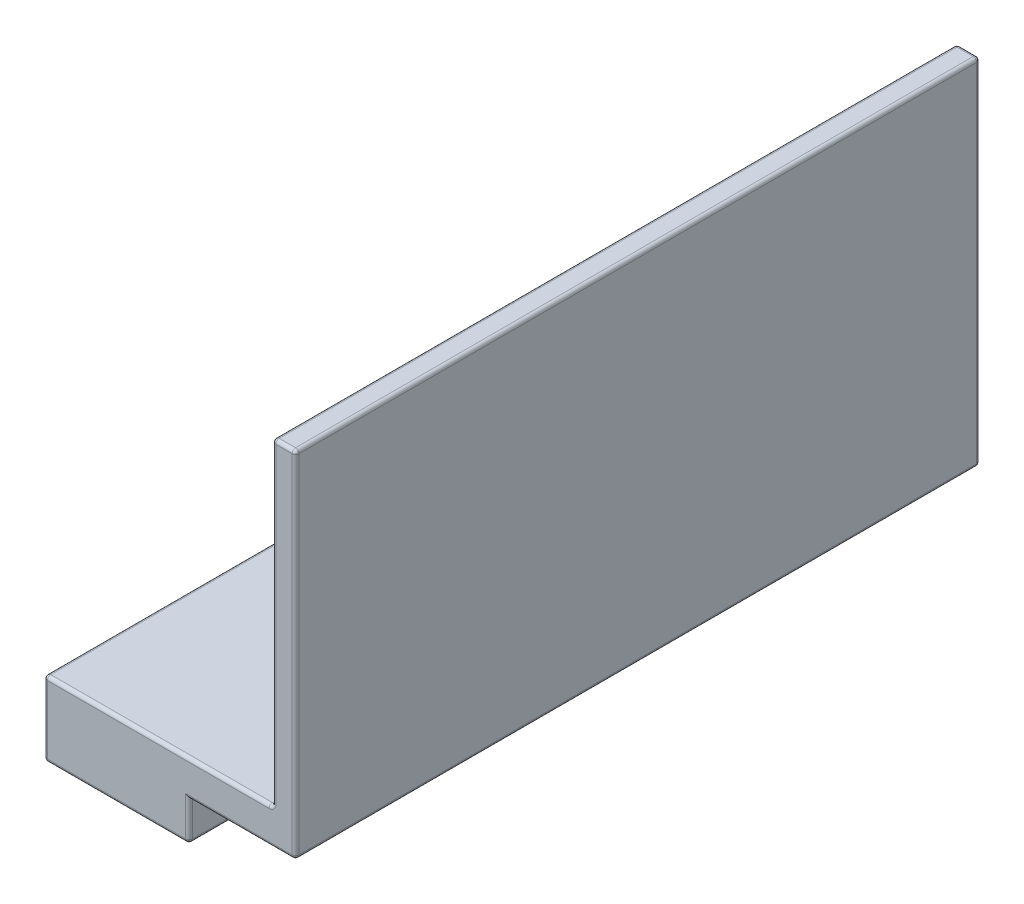
from build123d import *

# Parameters (mm, degrees)
BOSS_EXTRUDE1_DEPTH = 2000
CUT_EXTRUDE1_REACH  = 2423.496
SKETCH3_W           = 311
SKETCH3_H           = 115
SKETCH2_W           = 1960
SKETCH2_H           = 178.8
CUT_EXTRUDE2_DEPTH  = 310
FILLET2_R           = 10
FILLET3_R           = 2


with BuildPart() as part:
    # Sketch1 → Boss-Extrude1 (new body)
    with BuildSketch(Plane.XY):
        Polygon((0, 0), (735, 0), (735, 1150.4), (667.5, 1150.4), (667.5, 218.8), (0, 218.8), align=None)
    extrude(amount=BOSS_EXTRUDE1_DEPTH)

    # Sketch3 → Cut-Extrude1 (cut, up to next)
    with BuildSketch(Plane(origin=(0, 0, 0), x_dir=(-1, 0, 0), z_dir=(0, 0, -1)), mode=Mode.PRIVATE) as cut_extrude1_sk1:
        with Locations((-579.5, 57.5)):
            Rectangle(SKETCH3_W, SKETCH3_H)
    cut_extrude1_tool1 = extrude(cut_extrude1_sk1.sketch, amount=-CUT_EXTRUDE1_REACH, mode=Mode.PRIVATE) & part.part
    add(cut_extrude1_tool1.solids().sort_by_distance((579.5, 57.5, 0))[0], mode=Mode.SUBTRACT)

    # Sketch2 → Cut-Extrude2 (cut)
    with BuildSketch(Plane.ZY):
        with Locations((1000, 109.4)):
            Rectangle(SKETCH2_W, SKETCH2_H)
    extrude(amount=-CUT_EXTRUDE2_DEPTH, mode=Mode.SUBTRACT)

    # Fillet2
    fillet2_edges = [part.edges().sort_by_distance(p)[0] for p in [
        (735, 1150.4, 1000),
        (0, 0, 1000),
        (0, 218.8, 1000),
        (667.5, 218.8, 1000),
        (667.5, 1150.4, 1000),
        (333.75, 218.8, 2000),
        (0, 109.4, 2000),
        (735, 632.7, 0),
        (212, 0, 2000),
        (735, 632.7, 2000),
        (579.5, 115, 2000),
        (735, 115, 1000),
        (424, 57.5, 2000),
        (424, 0, 1000),
        (424, 57.5, 0),
        (579.5, 115, 0),
        (701.25, 1150.4, 2000),
        (212, 0, 0),
        (0, 109.4, 0),
        (333.75, 218.8, 0),
        (667.5, 684.6, 0),
        (701.25, 1150.4, 0),
        (667.5, 684.6, 2000),
    ]]
    fillet(fillet2_edges, radius=FILLET2_R)

    # Fillet3
    fillet3_edges = [part.edges().sort_by_distance(p)[0] for p in [
        (155, 198.8, 1980),
        (155, 20, 1980),
        (155, 20, 20),
        (155, 198.8, 20),
        (0, 109.4, 1980),
        (0, 198.8, 1000),
        (0, 109.4, 20),
        (0, 20, 1000),
    ]]
    fillet(fillet3_edges, radius=FILLET3_R)


solid = part.part
